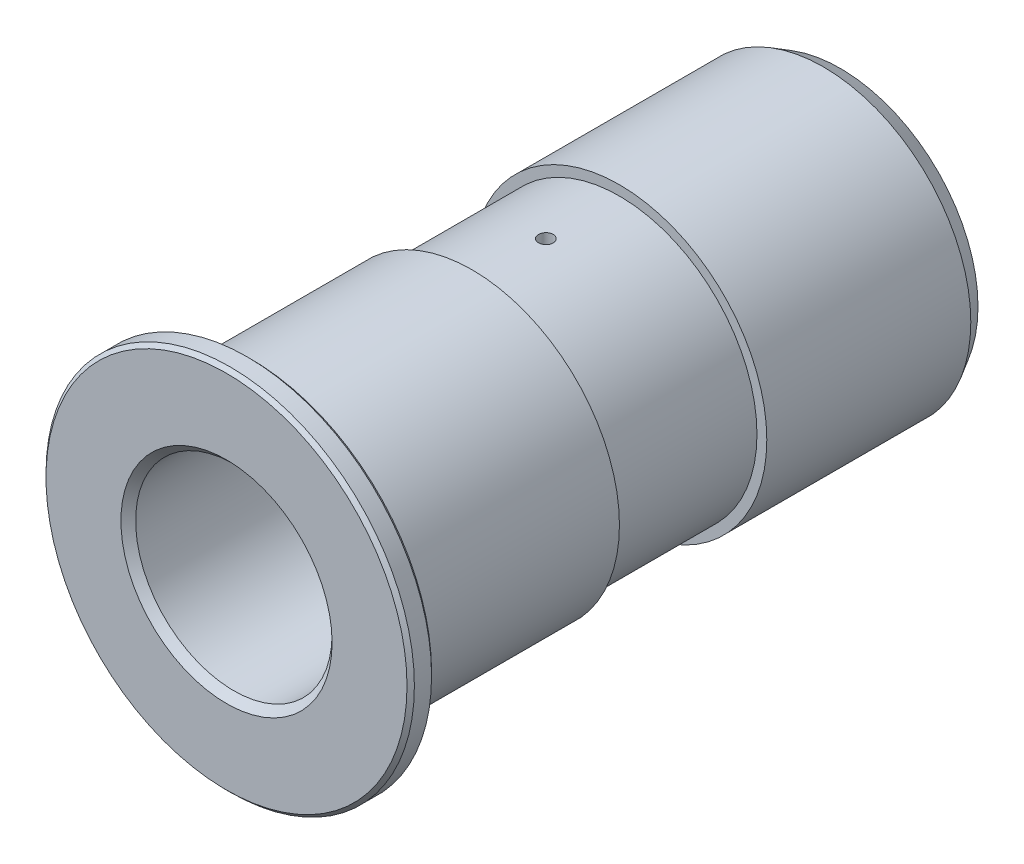
from build123d import *

# Parameters (mm, degrees)
SKETCH1_R               = 30
SKETCH1_R_2             = 20
MAIN_BODY_DEPTH         = 120
SKETCH2_R               = 37.5
SKETCH2_R_2             = 20
BOSS_LIP_DEPTH          = 5
SKETCH4_W               = 4
SKETCH4_H               = 30
BEARLING_CHAMFER_SIZE   = 2
BEARLING_CHAMFER_SIZE2  = 3.464101615
SHAFT_CHAMFER_SIZE      = 1.5
LIP_CHAMFER_SIZE        = 0.75
CUT_EXTRUDE2_REACH      = 137.785
CUT_EXTRUDE2_END_RADIUS = 28
SKETCH5_R               = 1.5


with BuildPart() as part:
    # Sketch1 → Main Body (new body)
    with BuildSketch(Plane.XY):
        Circle(SKETCH1_R)
        Circle(SKETCH1_R_2, mode=Mode.SUBTRACT)
    extrude(amount=MAIN_BODY_DEPTH)

    # Sketch2 → Boss_Lip (add)
    with BuildSketch(Plane.XY.offset(120)):
        Circle(SKETCH2_R)
        Circle(SKETCH2_R_2, mode=Mode.SUBTRACT)
    extrude(amount=BOSS_LIP_DEPTH)

    # Sketch4 → Relief (revolve, cut)
    with BuildSketch(Plane(origin=(0, 0, 0), x_dir=(1, 0, 0), z_dir=(0, 1, 0)), mode=Mode.PRIVATE) as relief_sk:
        with Locations((-30, -60)):
            Rectangle(SKETCH4_W, SKETCH4_H)
    revolve(relief_sk.sketch.rotate(Axis((0, 0, 84), (0, 0, -1)), 180), axis=Axis((0, 0, 84), (0, 0, -1)), mode=Mode.SUBTRACT)

    # Bearling Chamfer
    bearling_chamfer_edges = [part.edges().sort_by_distance(p)[0] for p in [
        (-30, 0, 0),
    ]]
    bearling_chamfer_side = [part.faces().sort_by_distance(p)[0] for p in [
        (-29.151471863, 0, 0),
    ]]
    chamfer(bearling_chamfer_edges, length=BEARLING_CHAMFER_SIZE, length2=BEARLING_CHAMFER_SIZE2, reference=bearling_chamfer_side[0])

    # Shaft Chamfer
    shaft_chamfer_edges = [part.edges().sort_by_distance(p)[0] for p in [
        (-20, 0, 125),
        (-20, 0, 0),
    ]]
    chamfer(shaft_chamfer_edges, length=SHAFT_CHAMFER_SIZE)

    # Lip Chamfer
    lip_chamfer_edges = [part.edges().sort_by_distance(p)[0] for p in [
        (-37.5, 0, 120),
        (-37.5, 0, 125),
    ]]
    chamfer(lip_chamfer_edges, length=LIP_CHAMFER_SIZE)

    # Cut-Extrude2: up to this cylinder (the profile starts inside it)
    cut_extrude2_end = Plane(origin=(0, 0, 60), z_dir=(0, 0, 1)) * Cylinder(CUT_EXTRUDE2_END_RADIUS, 332.57, mode=Mode.PRIVATE)
    # Sketch5 → Cut-Extrude2 (cut, up to the surface)
    with BuildSketch(Plane(origin=(0, 0, 0), x_dir=(1, 0, 0), z_dir=(0, 1, 0)), mode=Mode.PRIVATE) as cut_extrude2_sk1:
        with Locations(Location((0, -60, 0), (0, 0, 90))):
            Circle(SKETCH5_R)
    cut_extrude2_tool1 = extrude(cut_extrude2_sk1.sketch, amount=CUT_EXTRUDE2_REACH, mode=Mode.PRIVATE) & cut_extrude2_end
    add(cut_extrude2_tool1.solids().sort_by_distance((0, 0, 60))[0], mode=Mode.SUBTRACT)


solid = part.part
